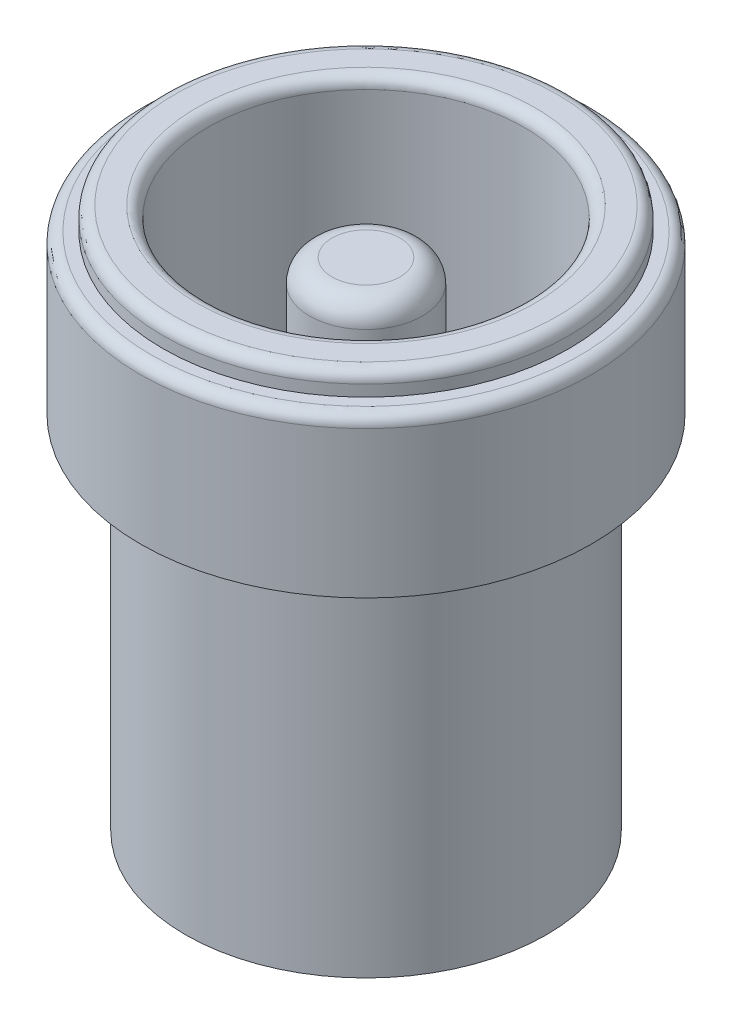
from build123d import *

# Parameters (mm, degrees)
SKETCH2_R            = 3.5
SKETCH2_R_2          = 1.25
INSIDE_CUT_DEPTH     = 10
SKETCH3_R            = 1.25
PIN_SHORTENING_DEPTH = 1
FILLET1_R            = 0.5
FILLET2_R            = 0.25


with BuildPart() as part:
    # Sketch1 → BULK (revolve)
    with BuildSketch(Plane.XY, mode=Mode.PRIVATE) as bulk_sk:
        Polygon((0, 0), (4.5, 0), (4.5, -0.5), (5, -0.5), (5, -4), (4, -4), (4, -12), (0, -12), align=None)
    revolve(bulk_sk.sketch.rotate(Axis((0, -12, 0), (0, 1, 0)), 90), axis=Axis((0, -12, 0), (0, 1, 0)))

    # Sketch2 → INSIDE CUT (cut)
    with BuildSketch(Plane(origin=(0, 0, 0), x_dir=(1, 0, 0), z_dir=(0, 1, 0))):
        with Locations(Location((0, 0, 0), (0, 0, 270))):
            Circle(SKETCH2_R)
        with Locations(Location((0, 0, 0), (0, 0, 270))):
            Circle(SKETCH2_R_2, mode=Mode.SUBTRACT)
    extrude(amount=-INSIDE_CUT_DEPTH, mode=Mode.SUBTRACT)

    # Sketch3 → PIN SHORTENING (cut)
    with BuildSketch(Plane(origin=(0, 0, 0), x_dir=(1, 0, 0), z_dir=(0, 1, 0))):
        with Locations(Location((0, 0, 0), (0, 0, 270))):
            Circle(SKETCH3_R)
    extrude(amount=-PIN_SHORTENING_DEPTH, mode=Mode.SUBTRACT)

    # Fillet1
    fillet1_edges = [part.edges().sort_by_distance(p)[0] for p in [
        (0, -1, -1.25),
    ]]
    fillet(fillet1_edges, radius=FILLET1_R)

    # Fillet2
    fillet2_edges = [part.edges().sort_by_distance(p)[0] for p in [
        (0, -10, -3.5),
        (0, 0, -3.5),
        (0, -0.5, 5),
        (0, 0, 4.5),
    ]]
    fillet(fillet2_edges, radius=FILLET2_R)


solid = part.part
